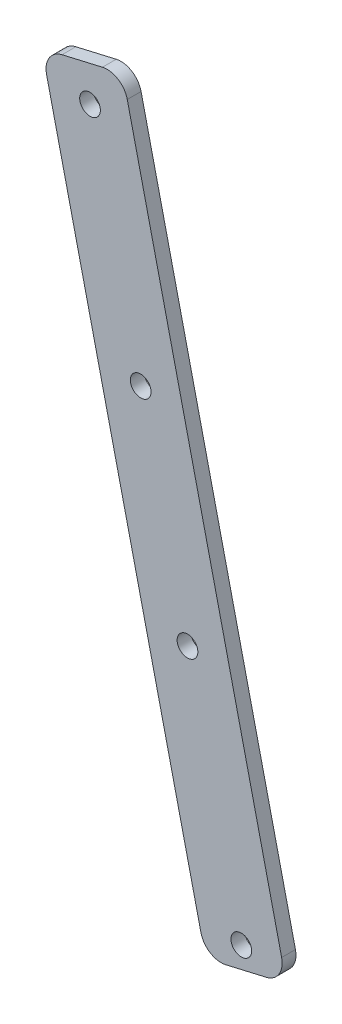
from build123d import *

# Parameters (mm, degrees)
SKETCH_1_R      = 1.5
EXTRUDE_1_DEPTH = 2


with BuildPart() as part:
    # 草图1 → 凸台-拉伸1 (new body)
    with BuildSketch(Plane.XY):
        with BuildLine():
            Line((-13.636160957, 32.253761243), (8.721085584, -64.18872694))
            ThreePointArc((8.721085584, -64.18872694), (10.056125324, -66.056813349), (12.321077545, -66.433734263))
            Line((12.321077545, -66.433734263), (18.166076829, -65.078749624))
            ThreePointArc((18.166076829, -65.078749624), (20.034163238, -63.743709884), (20.411084152, -61.478757663))
            Line((20.411084152, -61.478757663), (-1.94616239, 34.963730521))
            ThreePointArc((-1.94616239, 34.963730521), (-3.28120213, 36.83181693), (-5.546154351, 37.208737844))
            Line((-5.546154351, 37.208737844), (-11.391153635, 35.853753205))
            ThreePointArc((-11.391153635, 35.853753205), (-13.259240043, 34.518713464), (-13.636160957, 32.253761243))
        make_face()
        with Locations((-7.339500127, 31.660412788)):
            Circle(SKETCH_1_R, mode=Mode.SUBTRACT)
        Circle(SKETCH_1_R, mode=Mode.SUBTRACT)
        with Locations((6.774923194, -29.224996419)):
            Circle(SKETCH_1_R, mode=Mode.SUBTRACT)
        with Locations((14.566084868, -62.833742302)):
            Circle(SKETCH_1_R, mode=Mode.SUBTRACT)
    extrude(amount=EXTRUDE_1_DEPTH)


solid = part.part
